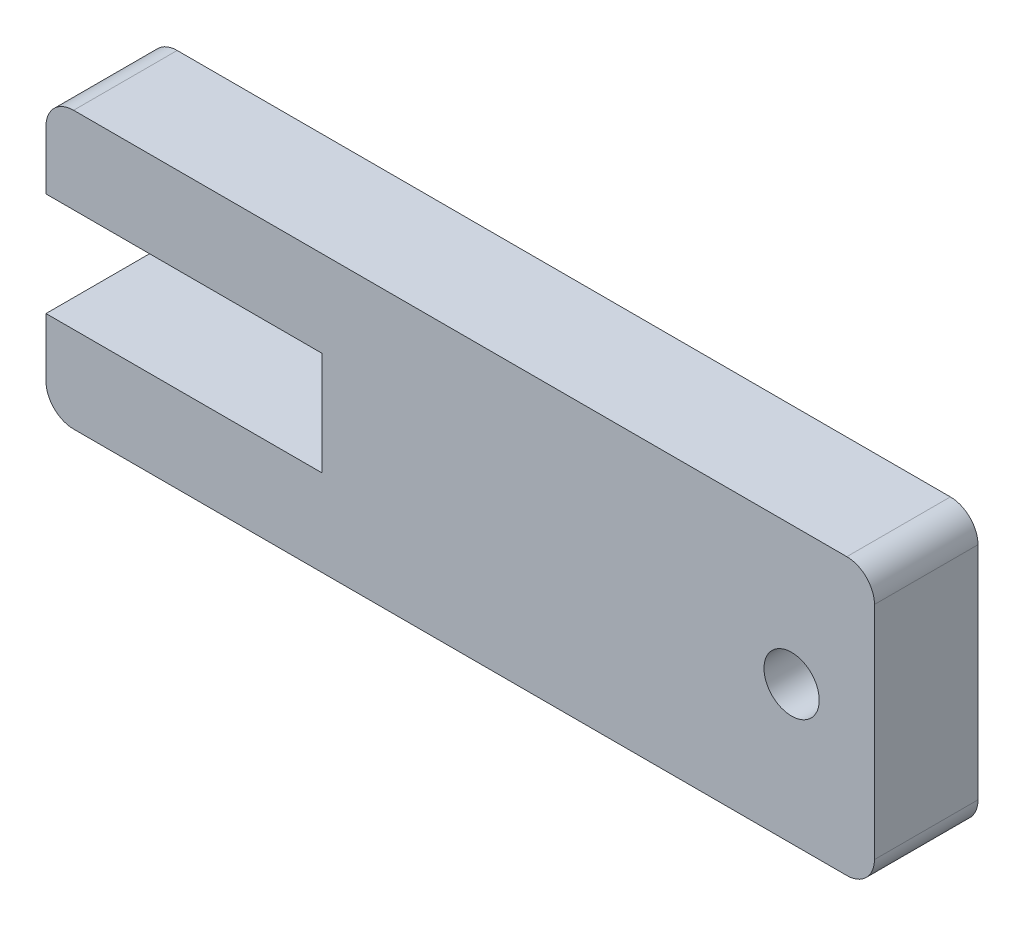
from build123d import *

# Parameters (mm, degrees)
BOSS_EXTRUDE1_DEPTH = 2.38125
FILLET1_R           = 1.27
SKETCH2_R           = 1.27
CUT_EXTRUDE1_DEPTH  = 27.6113492


with BuildPart() as part:
    # Sketch1 → Boss-Extrude1 (new, symmetric)
    with BuildSketch(Plane.XY):
        Polygon((-12.7, 2.38125), (-12.7, 6.35), (25.4, 6.35), (25.4, -6.35), (-12.7, -6.35), (-12.7, -2.38125), (0, -2.38125), (0, 2.38125), align=None)
    extrude(amount=BOSS_EXTRUDE1_DEPTH, both=True)

    # Fillet1
    fillet1_edges = [part.edges().sort_by_distance(p)[0] for p in [
        (-12.7, -6.35, 0),
        (25.4, -6.35, 0),
        (25.4, 6.35, 0),
        (-12.7, 6.35, 0),
    ]]
    fillet(fillet1_edges, radius=FILLET1_R)

    # Sketch2 → Cut-Extrude1 (cut, through all)
    with BuildSketch(Plane.XY.offset(2.38125)):
        with Locations((21.59, 0)):
            Circle(SKETCH2_R)
    extrude(amount=-CUT_EXTRUDE1_DEPTH, mode=Mode.SUBTRACT)


solid = part.part
